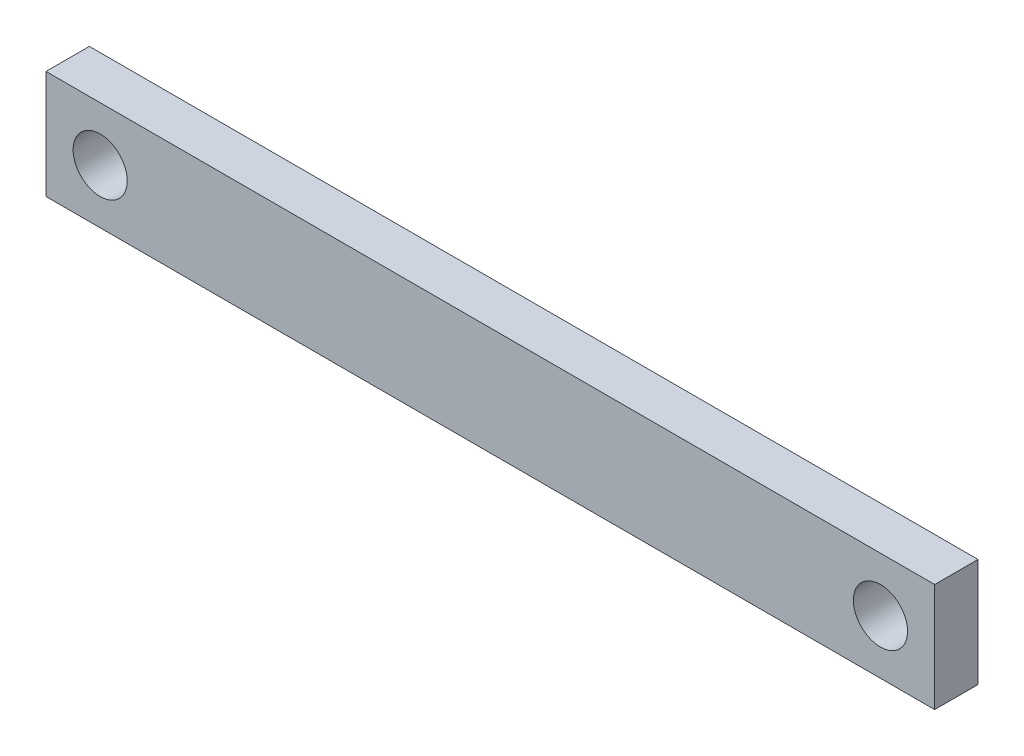
from build123d import *

# Parameters (mm, degrees)
SKETCH_1_W      = 41
SKETCH_1_H      = 5
SKETCH_1_R      = 1.25
EXTRUDE_1_DEPTH = 2


with BuildPart() as part:
    # 草圖1 → 填料-伸長1 (new body)
    with BuildSketch(Plane.XY):
        with Locations((3.291635048, 9.320201418)):
            Rectangle(SKETCH_1_W, SKETCH_1_H)
        with Locations((-14.708364952, 9.320201418)):
            Circle(SKETCH_1_R, mode=Mode.SUBTRACT)
        with Locations((21.291635048, 9.320201418)):
            Circle(SKETCH_1_R, mode=Mode.SUBTRACT)
    extrude(amount=EXTRUDE_1_DEPTH)


solid = part.part
